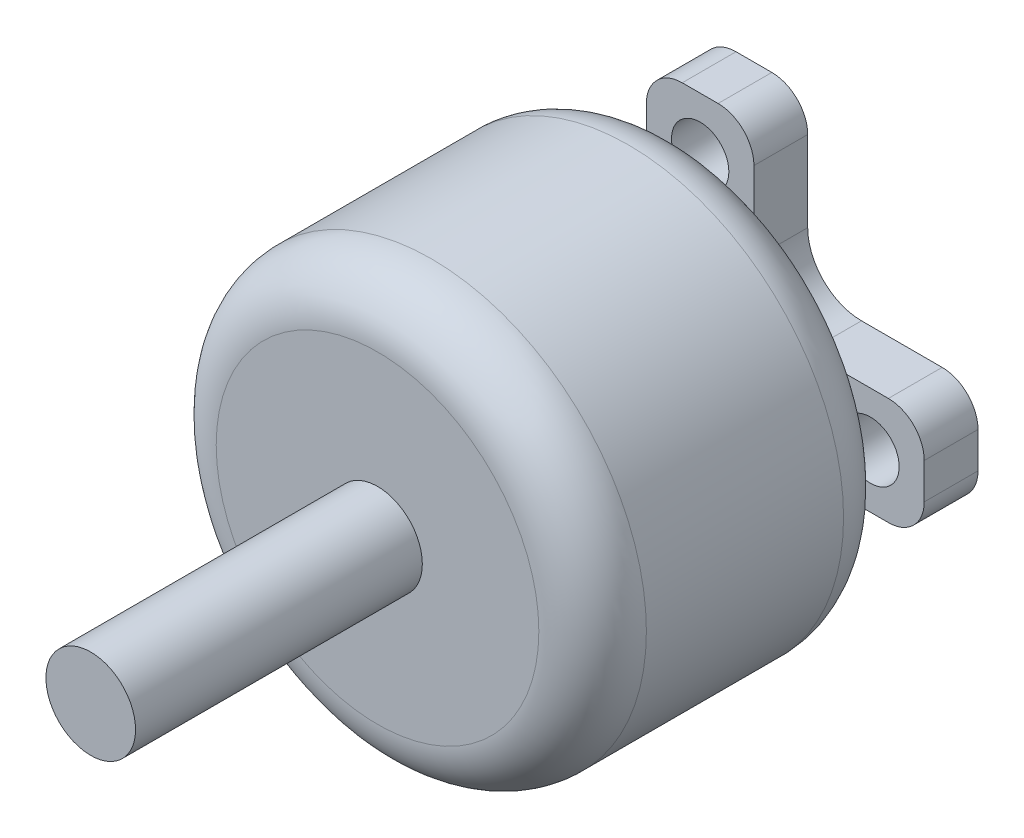
from build123d import *

# Parameters (mm, degrees)
SKETCH1_R           = 1.6
BOSS_EXTRUDE1_DEPTH = 3
SKETCH2_R           = 2.852011264
BOSS_EXTRUDE2_DEPTH = 1
SKETCH3_R           = 12
BOSS_EXTRUDE3_DEPTH = 17
SKETCH4_R           = 2.5
BOSS_EXTRUDE4_DEPTH = 16
FILLET1_R           = 3


with BuildPart() as part:
    # Sketch1 → Boss-Extrude1 (new body)
    with BuildSketch(Plane.XY):
        with BuildLine():
            Line((-71.781745931, -74.781745931), (-67.281745931, -74.781745931))
            ThreePointArc((-67.281745931, -74.781745931), (-65.867532368, -75.367532368), (-65.281745931, -76.781745931))
            Line((-65.281745931, -76.781745931), (-65.281745931, -78.781745931))
            ThreePointArc((-65.281745931, -78.781745931), (-65.867532368, -80.195959493), (-67.281745931, -80.781745931))
            Line((-67.281745931, -80.781745931), (-71.781745931, -80.781745931))
            ThreePointArc((-71.781745931, -80.781745931), (-73.903066274, -81.660425587), (-74.781745931, -83.781745931))
            Line((-74.781745931, -83.781745931), (-74.781745931, -88.281745931))
            ThreePointArc((-74.781745931, -88.281745931), (-75.367532368, -89.695959493), (-76.781745931, -90.281745931))
            Line((-76.781745931, -90.281745931), (-78.781745931, -90.281745931))
            ThreePointArc((-78.781745931, -90.281745931), (-80.195959493, -89.695959493), (-80.781745931, -88.281745931))
            Line((-80.781745931, -88.281745931), (-80.781745931, -83.781745931))
            ThreePointArc((-80.781745931, -83.781745931), (-81.660425587, -81.660425587), (-83.781745931, -80.781745931))
            Line((-83.781745931, -80.781745931), (-88.281745931, -80.781745931))
            ThreePointArc((-88.281745931, -80.781745931), (-89.695959493, -80.195959493), (-90.281745931, -78.781745931))
            Line((-90.281745931, -78.781745931), (-90.281745931, -76.781745931))
            ThreePointArc((-90.281745931, -76.781745931), (-89.695959493, -75.367532368), (-88.281745931, -74.781745931))
            Line((-88.281745931, -74.781745931), (-83.781745931, -74.781745931))
            ThreePointArc((-83.781745931, -74.781745931), (-81.660425587, -73.903066274), (-80.781745931, -71.781745931))
            Line((-80.781745931, -71.781745931), (-80.781745931, -67.281745931))
            ThreePointArc((-80.781745931, -67.281745931), (-80.195959493, -65.867532368), (-78.781745931, -65.281745931))
            Line((-78.781745931, -65.281745931), (-76.781745931, -65.281745931))
            ThreePointArc((-76.781745931, -65.281745931), (-75.367532368, -65.867532368), (-74.781745931, -67.281745931))
            Line((-74.781745931, -67.281745931), (-74.781745931, -71.781745931))
            ThreePointArc((-74.781745931, -71.781745931), (-73.903066274, -73.903066274), (-71.781745931, -74.781745931))
        make_face()
        with Locations((-77.781745931, -68.281745931)):
            Circle(SKETCH1_R, mode=Mode.SUBTRACT)
        with Locations((-68.281745931, -77.781745931)):
            Circle(SKETCH1_R, mode=Mode.SUBTRACT)
        with Locations((-77.781745931, -87.281745931)):
            Circle(SKETCH1_R, mode=Mode.SUBTRACT)
        with Locations((-87.281745931, -77.781745931)):
            Circle(SKETCH1_R, mode=Mode.SUBTRACT)
    extrude(amount=BOSS_EXTRUDE1_DEPTH)

    # Sketch2 → Boss-Extrude2 (add)
    with BuildSketch(Plane.XY.offset(3)):
        with Locations((-77.781745931, -77.781745931)):
            Circle(SKETCH2_R)
    extrude(amount=BOSS_EXTRUDE2_DEPTH)

    # Sketch3 → Boss-Extrude3 (add)
    with BuildSketch(Plane.XY.offset(4)):
        with Locations((-77.781745931, -77.781745931)):
            Circle(SKETCH3_R)
    extrude(amount=BOSS_EXTRUDE3_DEPTH)

    # Sketch4 → Boss-Extrude4 (add)
    with BuildSketch(Plane.XY.offset(21)):
        with Locations((-77.781745931, -77.781745931)):
            Circle(SKETCH4_R)
    extrude(amount=BOSS_EXTRUDE4_DEPTH)

    # Fillet1
    fillet1_edges = [part.edges().sort_by_distance(p)[0] for p in [
        (-89.781745931, -77.781745931, 4),
        (-89.781745931, -77.781745931, 21),
    ]]
    fillet(fillet1_edges, radius=FILLET1_R)


solid = part.part
